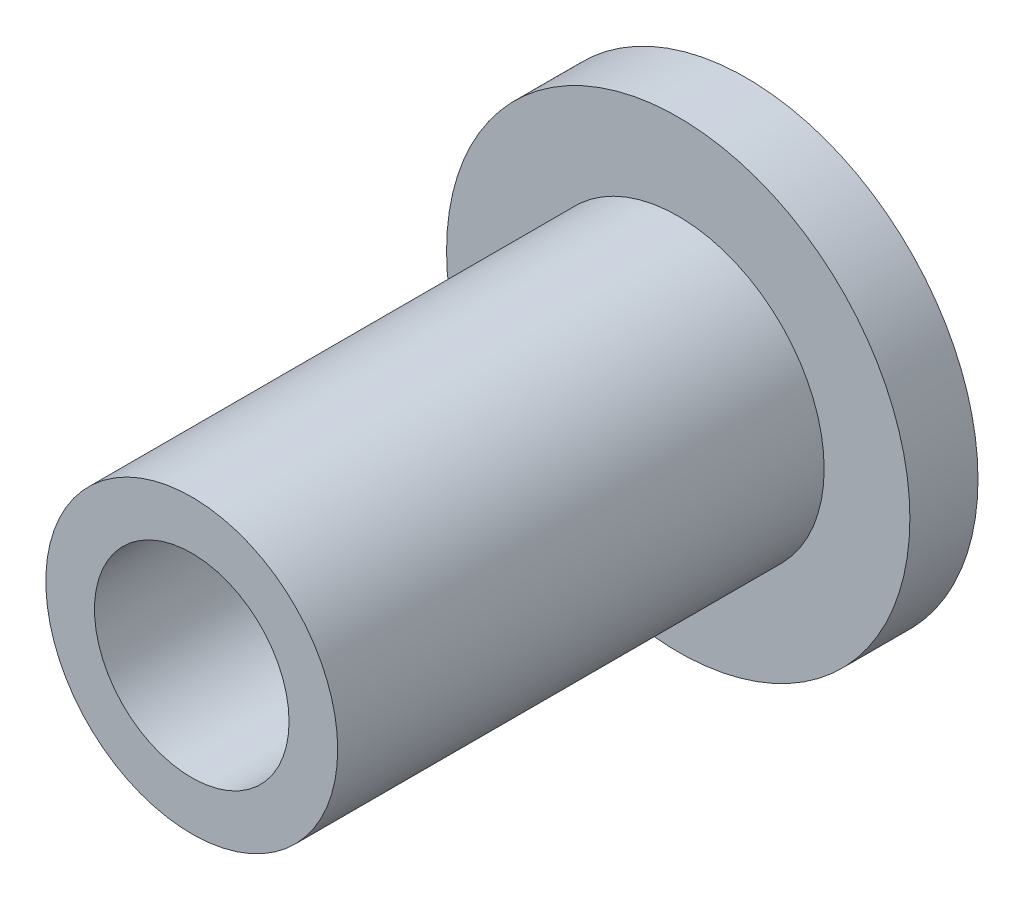
from build123d import *

# Parameters (mm, degrees)
SKETCH1_R           = 4.7625
SKETCH1_R_2         = 2
BOSS_EXTRUDE1_DEPTH = 1.4
SKETCH2_R           = 3
SKETCH2_R_2         = 2
BOSS_EXTRUDE2_DEPTH = 10


with BuildPart() as part:
    # Sketch1 → Boss-Extrude1 (new body)
    with BuildSketch(Plane(origin=(0, 0, 0), x_dir=(0, 1, 0), z_dir=(0, 0, 1))):
        with Locations(Location((0, 0, 0), (0, 0, 270))):
            Circle(SKETCH1_R)
        with Locations(Location((0, 0, 0), (0, 0, 270))):
            Circle(SKETCH1_R_2, mode=Mode.SUBTRACT)
    extrude(amount=BOSS_EXTRUDE1_DEPTH)

    # Sketch2 → Boss-Extrude2 (add)
    with BuildSketch(Plane.XY.offset(1.4)):
        Circle(SKETCH2_R)
        Circle(SKETCH2_R_2, mode=Mode.SUBTRACT)
    extrude(amount=BOSS_EXTRUDE2_DEPTH)


solid = part.part
